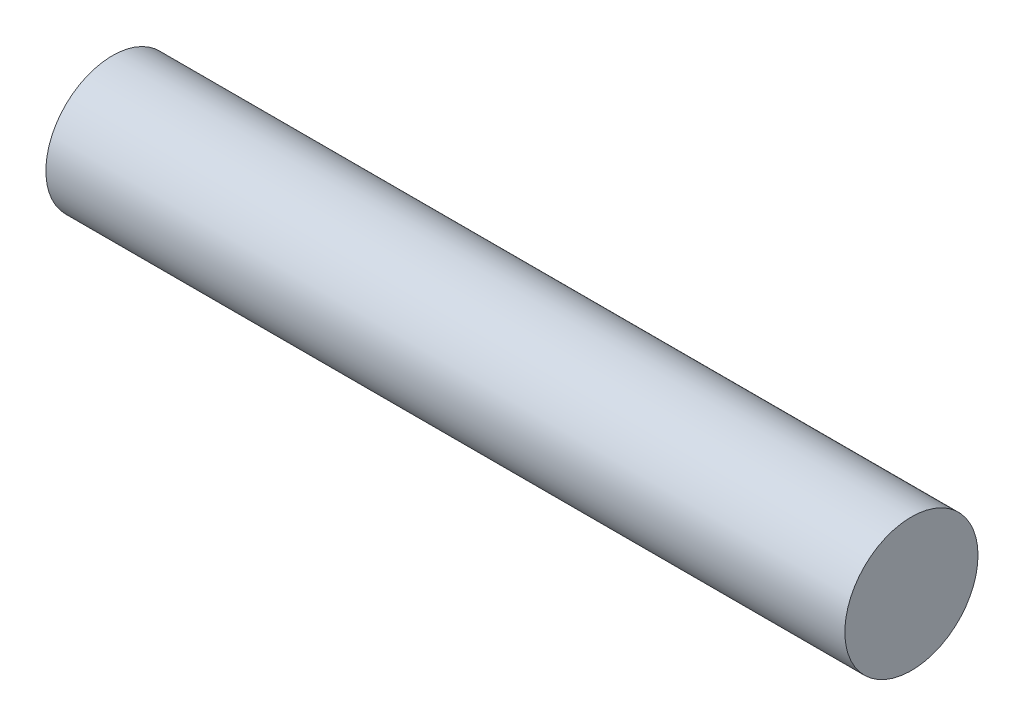
from build123d import *

# Parameters (mm, degrees)
SKETCH1_R           = 15
BOSS_EXTRUDE1_DEPTH = 180


with BuildPart() as part:
    # Sketch1 → Boss-Extrude1 (new body)
    with BuildSketch(Plane(origin=(0, 0, 0), x_dir=(0, 0, -1), z_dir=(1, 0, 0))):
        Circle(SKETCH1_R)
    extrude(amount=-BOSS_EXTRUDE1_DEPTH)


solid = part.part
